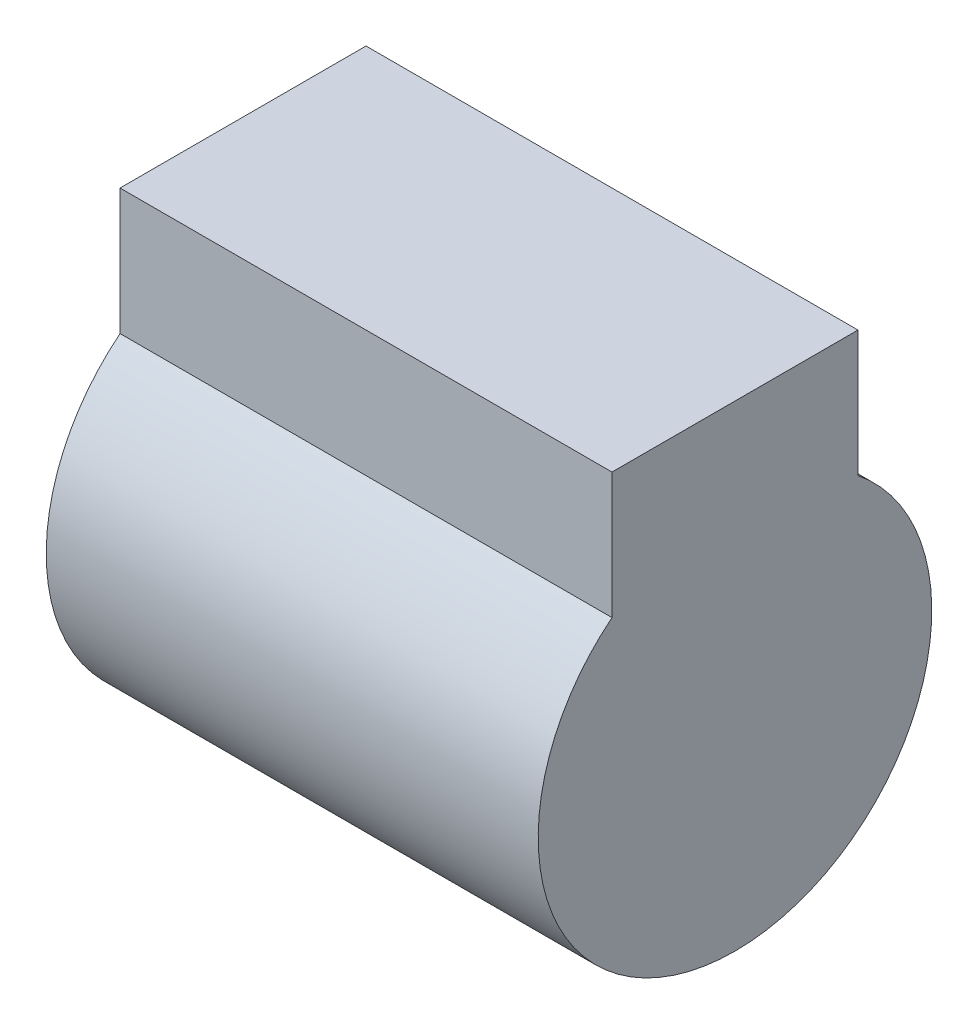
from build123d import *

# Parameters (mm, degrees)
SKETCH2_R           = 16
BOSS_EXTRUDE1_DEPTH = 40
SKETCH3_R           = 3.75
CUT_EXTRUDE1_DEPTH  = 8.5
BOSS_EXTRUDE3_DEPTH = 40


with BuildPart() as part:
    # Sketch2 → Boss-Extrude1 (new body)
    with BuildSketch(Plane(origin=(0, 0, 0), x_dir=(0, 0, -1), z_dir=(1, 0, 0))):
        Circle(SKETCH2_R)
    extrude(amount=BOSS_EXTRUDE1_DEPTH)

    # Sketch3 → Cut-Extrude1 (cut)
    with BuildSketch(Plane(origin=(0, 0, 0), x_dir=(0, 0, -1), z_dir=(1, 0, 0))):
        Circle(SKETCH3_R)
    extrude(amount=CUT_EXTRUDE1_DEPTH, mode=Mode.SUBTRACT)

    # Sketch4 → Boss-Extrude3 (add, through all)
    with BuildSketch(Plane(origin=(0, 0, 0), x_dir=(0, 0, -1), z_dir=(1, 0, 0))):
        Polygon((10, 12.489995997), (-10, 12.489995997), (-10, 15.822191594), (-10, 22.739406358), (10, 22.739406358), align=None)
    extrude(amount=BOSS_EXTRUDE3_DEPTH)


solid = part.part
